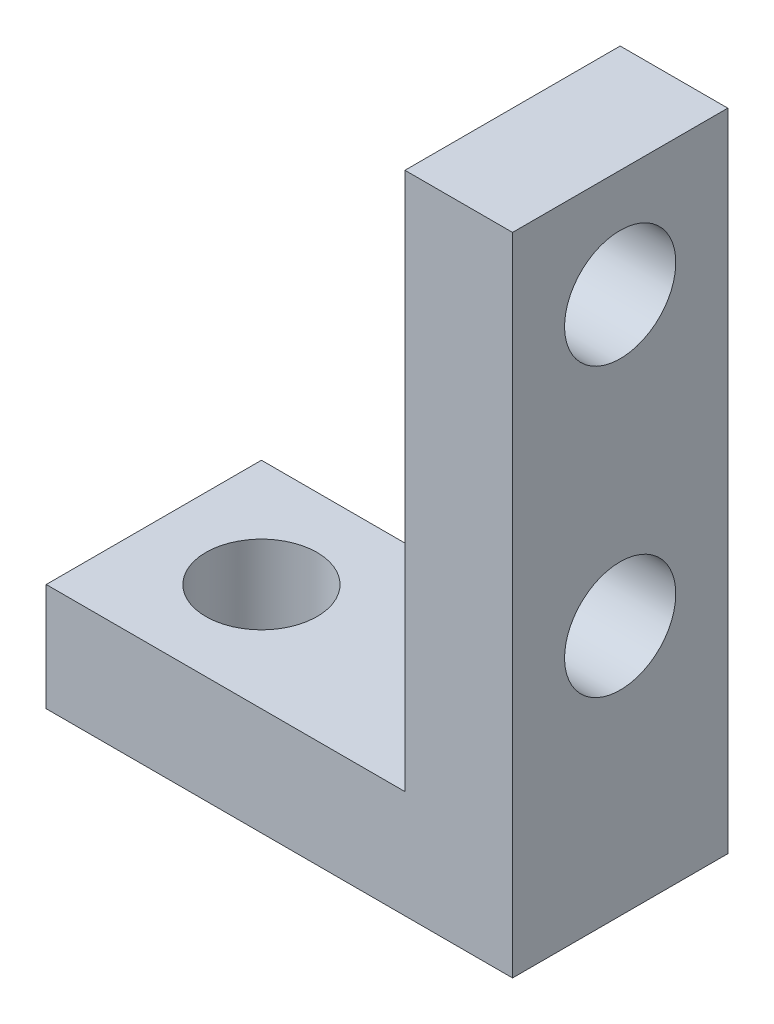
from build123d import *

# Parameters (mm, degrees)
BOSS_EXTRUDE1_DEPTH = 6
SKETCH3_R           = 1.55
CUT_EXTRUDE1_DEPTH  = 17.911534525
SKETCH5_R           = 1.55
CUT_EXTRUDE2_DEPTH  = 21.05617112


with BuildPart() as part:
    # Sketch1 → Boss-Extrude1 (new body)
    with BuildSketch(Plane.XY):
        Polygon((3.5, -6), (0.5, -6), (-6.5, -6), (-6.5, -9), (6.5, -9), (6.5, 9), (3.5, 9), (3.5, -4.7), align=None)
    extrude(amount=BOSS_EXTRUDE1_DEPTH)

    # Sketch3 → Cut-Extrude1 (cut, through all)
    with BuildSketch(Plane(origin=(6.5, 0, 0), x_dir=(0, 0, -1), z_dir=(1, 0, 0))):
        with Locations(Location((-3, 6, 0), (0, 0, 90))):
            Circle(SKETCH3_R)
        with Locations(Location((-3, -2, 0), (0, 0, 90))):
            Circle(SKETCH3_R)
    extrude(amount=-CUT_EXTRUDE1_DEPTH, mode=Mode.SUBTRACT)

    # Sketch5 → Cut-Extrude2 (cut, through all)
    with BuildSketch(Plane.XZ.offset(9)):
        with Locations(Location((-3.5, 3, 0), (0, 0, 270))):
            Circle(SKETCH5_R)
    extrude(amount=-CUT_EXTRUDE2_DEPTH, mode=Mode.SUBTRACT)


solid = part.part
